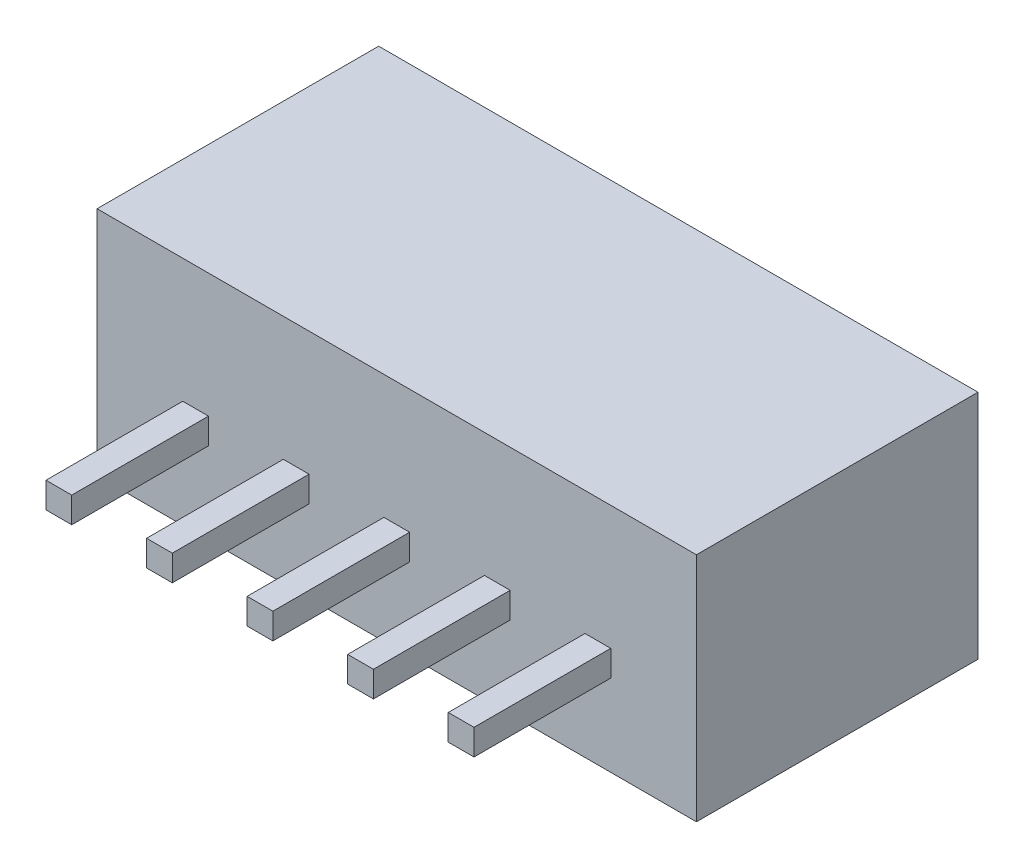
from build123d import *

# Parameters (mm, degrees)
SKETCH_1_W          = 14.9
SKETCH_1_H          = 5.75
EXTRUDE_1_DEPTH     = 7
SKETCH_2_W          = 0.64
SKETCH_2_H          = 0.64
EXTRUDE_2_DEPTH     = 3.4
SKETCH_3_W          = 12.9
SKETCH_3_H          = 3.75
CUT_EXTRUDE_1_DEPTH = 5


with BuildPart() as part:
    # Эскиз1 → Бобышка-Вытянуть1 (new body)
    with BuildSketch(Plane.XY):
        Rectangle(SKETCH_1_W, SKETCH_1_H)
    extrude(amount=EXTRUDE_1_DEPTH)

    # Эскиз2 → Бобышка-Вытянуть2 (add)
    with BuildSketch(Plane.XY.offset(7)):
        with Locations((-2.5, -0.525)):
            Rectangle(SKETCH_2_W, SKETCH_2_H)
        with Locations((-5, -0.525)):
            Rectangle(SKETCH_2_W, SKETCH_2_H)
        with Locations((0, -0.525)):
            Rectangle(SKETCH_2_W, SKETCH_2_H)
        with Locations((2.5, -0.525)):
            Rectangle(SKETCH_2_W, SKETCH_2_H)
        with Locations((5, -0.525)):
            Rectangle(SKETCH_2_W, SKETCH_2_H)
    extrude(amount=EXTRUDE_2_DEPTH)

    # Эскиз3 → Вырез-Вытянуть1 (cut)
    with BuildSketch(Plane(origin=(0, 0, 0), x_dir=(-1, 0, 0), z_dir=(0, 0, -1))):
        Rectangle(SKETCH_3_W, SKETCH_3_H)
    extrude(amount=-CUT_EXTRUDE_1_DEPTH, mode=Mode.SUBTRACT)


solid = part.part
